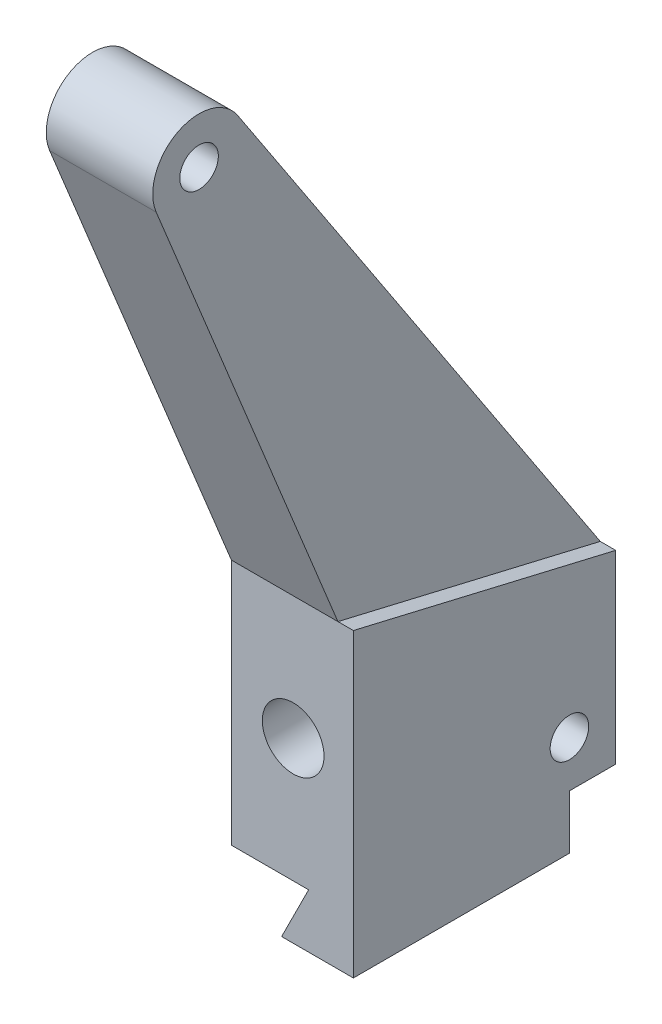
from build123d import *

# Parameters (mm, degrees)
SKETCH1_R             = 1.25
BOSS_EXTRUDE1_DEPTH   = 8
CUT_EXTRUDE2_DEPTH    = 61.942595941
M3X0_5_TAPPED_HOLE1_D = 2.5
SKETCH7_W             = 8
SKETCH7_H             = 0.5
CUT_EXTRUDE3_DEPTH    = 61.942595941
SKETCH8_R             = 2
CUT_EXTRUDE4_DEPTH    = 57.231663678
SKETCH9_W             = 38.671878994
SKETCH9_H             = 56.45112265
CUT_EXTRUDE5_DEPTH    = 8.1
CUT_EXTRUDE6_DEPTH    = 3
CUT_EXTRUDE8_START    = -1
CUT_EXTRUDE8_DEPTH    = 1


with BuildPart() as part:
    # Sketch1 → Boss-Extrude1 (new body)
    with BuildSketch(Plane(origin=(0, 0, 0), x_dir=(0, 0, -1), z_dir=(1, 0, 0))):
        with BuildLine():
            Line((0, 0), (0, 16))
            Line((0, 16), (-23.49505807, 51.650837947))
            ThreePointArc((-23.49505807, 51.650837947), (-27.398738146, 52.653965259), (-28.777698581, 48.866690426))
            Line((-28.777698581, 48.866690426), (-17, 20))
            Line((-17, 20), (-17, 0))
            Line((-17, 0), (0, 0))
        make_face()
        with Locations((-26, 50)):
            Circle(SKETCH1_R, mode=Mode.SUBTRACT)
    boss_extrude1 = extrude(amount=BOSS_EXTRUDE1_DEPTH)

    # Sketch3 → Cut-Extrude2 (cut, through all)
    with BuildSketch(Plane(origin=(0, 0, 0), x_dir=(-1, 0, 0), z_dir=(0, 0, -1))):
        Polygon((-8, 0), (-5, 0), (-3, 4), (-8, 4), align=None)
    cut_extrude2 = extrude(amount=-CUT_EXTRUDE2_DEPTH, mode=Mode.SUBTRACT)

    # M3x0.5 Tapped Hole1 (through all)
    with Locations(Plane(origin=(8, 7, 3), x_dir=(0, 0, 1), z_dir=(1, 0, 0))):
        with Locations((0, 0)):
            m3x0_5_tapped_hole1 = Hole(M3X0_5_TAPPED_HOLE1_D / 2)

    # Sketch7 → Cut-Extrude3 (cut, through all)
    with BuildSketch(Plane(origin=(0, 0, 0), x_dir=(-1, 0, 0), z_dir=(0, 0, -1))):
        with Locations((-4, 0.25)):
            Rectangle(SKETCH7_W, SKETCH7_H)
    cut_extrude3 = extrude(amount=-CUT_EXTRUDE3_DEPTH, mode=Mode.SUBTRACT)

    # Sketch8 → Cut-Extrude4 (cut, through all)
    with BuildSketch(Plane.XY.offset(17)):
        with Locations((4, 12)):
            Circle(SKETCH8_R)
    cut_extrude4 = extrude(amount=-CUT_EXTRUDE4_DEPTH, mode=Mode.SUBTRACT)

    # Mirror1: Boss-Extrude1, Cut-Extrude2, M3x0.5 Tapped Hole1, Cut-Extrude3, Cut-Extrude4 across plane
    add(boss_extrude1.mirror(Plane(origin=(0, 50, 26), x_dir=(0, 0, 1), z_dir=(1, 0, 0))))
    add(cut_extrude2.mirror(Plane(origin=(0, 50, 26), x_dir=(0, 0, 1), z_dir=(1, 0, 0))), mode=Mode.SUBTRACT)
    add(m3x0_5_tapped_hole1.mirror(Plane(origin=(0, 50, 26), x_dir=(0, 0, 1), z_dir=(1, 0, 0))), mode=Mode.SUBTRACT)
    add(cut_extrude3.mirror(Plane(origin=(0, 50, 26), x_dir=(0, 0, 1), z_dir=(1, 0, 0))), mode=Mode.SUBTRACT)
    add(cut_extrude4.mirror(Plane(origin=(0, 50, 26), x_dir=(0, 0, 1), z_dir=(1, 0, 0))), mode=Mode.SUBTRACT)

    # Sketch9 → Cut-Extrude5 (cut)
    with BuildSketch(Plane(origin=(8, 0, 0), x_dir=(0, 0, -1), z_dir=(1, 0, 0))):
        with Locations((-19.335939497, 28.725561325)):
            Rectangle(SKETCH9_W, SKETCH9_H)
    extrude(amount=-CUT_EXTRUDE5_DEPTH, mode=Mode.SUBTRACT)

    # Sketch10 → Cut-Extrude6 (cut)
    with BuildSketch(Plane(origin=(0, 0, 0), x_dir=(-1, 0, 0), z_dir=(0, 0, -1))):
        Polygon((4.75, 0.5), (3, 4), (0.1, 4), (0.1, 0.5), align=None)
    extrude(amount=-CUT_EXTRUDE6_DEPTH, mode=Mode.SUBTRACT)

    # Sketch12 → Cut-Extrude8 (cut)
    with BuildSketch(Plane(origin=(-0.1, 0, 0), x_dir=(0, 0, -1), z_dir=(1, 0, 0)).offset(CUT_EXTRUDE8_START)):
        with BuildLine():
            Line((-17, 20), (-28.777698581, 48.866690426))
            ThreePointArc((-28.777698581, 48.866690426), (-27.398738146, 52.653965259), (-23.49505807, 51.650837947))
            Line((-23.49505807, 51.650837947), (0, 16))
            Line((0, 16), (-17, 20))
        make_face()
    extrude(amount=CUT_EXTRUDE8_DEPTH, mode=Mode.SUBTRACT)


solid = part.part
